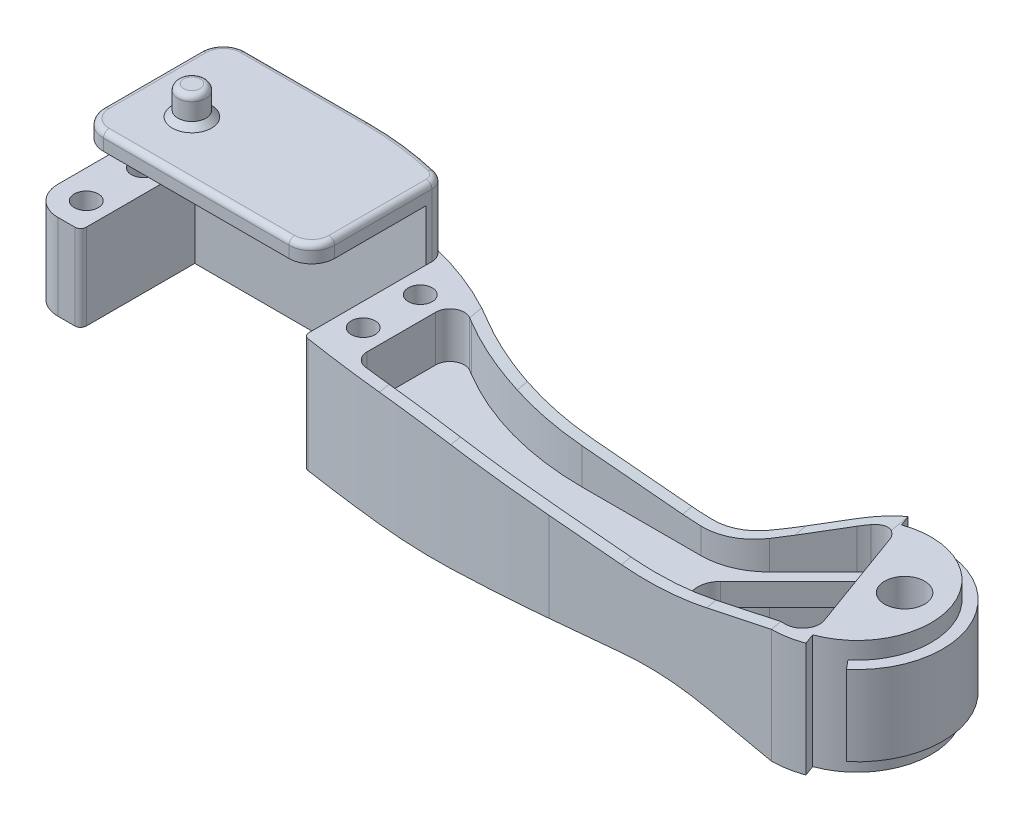
from build123d import *

# Parameters (mm, degrees)
CROQUIS1_R              = 3.5
SALIENTE_EXTRUIR1_DEPTH = 2
CROQUIS2_R              = 3.5
SALIENTE_EXTRUIR2_DEPTH = 10
SALIENTE_EXTRUIR3_DEPTH = 7
CORTAR_EXTRUIR1_DEPTH   = 83.665164829
CORTAR_EXTRUIR3_DEPTH   = 5
SALIENTE_EXTRUIR4_START = 9
SALIENTE_EXTRUIR4_DEPTH = 9
SALIENTE_EXTRUIR5_START = 3
SALIENTE_EXTRUIR5_DEPTH = 3
CROQUIS10_R             = 2.1
CORTAR_EXTRUIR4_DEPTH   = 83.909589369
CROQUIS11_R             = 2.45
SALIENTE_EXTRUIR6_DEPTH = 5
REDONDEO1_R             = 1
CHAFL_N1_SIZE           = 1
REDONDEO2_R             = 1


with BuildPart() as part:
    # Croquis1 → Saliente-Extruir1 (new, symmetric)
    with BuildSketch(Plane(origin=(0, 0, 0), x_dir=(1, 0, 0), z_dir=(0, 1, 0))):
        with BuildLine():
            Line((-65, 15), (-40.296472568, 15))
            ThreePointArc((-40.296472568, 15), (-25.597104262, 12.999326141), (-11.967141117, 7.142857143))
            ThreePointArc((-11.967141117, 7.142857143), (0.423734469, 1.818794417), (13.786796564, 0))
            Line((13.786796564, 0), (34.644660941, 0))
            ThreePointArc((34.644660941, 0), (38.471495264, 0.761204675), (41.715728753, 2.928932188))
            Line((41.715728753, 2.928932188), (49.393398282, 10.606601718))
            ThreePointArc((49.393398282, 10.606601718), (51.940505875, 12.650871687), (54.86969785, 14.095389312))
            Line((54.86969785, 14.095389312), (55.553738137, 12.21600407))
            ThreePointArc((55.553738137, 12.21600407), (57.74257369, 12.802500789), (60, 13))
            Line((60, 13), (60, 15))
            ThreePointArc((60, 15), (74.095389312, 5.13030215), (69.641814145, -11.490666647))
            Line((69.641814145, -11.490666647), (68.356238926, -9.958577761))
            ThreePointArc((68.356238926, -9.958577761), (66.5, -11.258330249), (64.446261863, -12.21600407))
            Line((64.446261863, -12.21600407), (65.13030215, -14.095389312))
            ThreePointArc((65.13030215, -14.095389312), (62.604722665, -14.772116295), (60, -15))
            Line((60, -15), (21, -15))
            ThreePointArc((21, -15), (-1.892838305, -14.125254625), (-24.652173913, -11.506119696))
            ThreePointArc((-24.652173913, -11.506119696), (-25.259003924, -11.168852013), (-25.5, -10.517765963))
            Line((-25.5, -10.517765963), (-25.5, 10))
            Line((-25.5, 10), (-66, 10))
            Line((-66, 10), (-66, -9))
            ThreePointArc((-66, -9), (-66.292893219, -9.707106781), (-67, -10))
            Line((-67, -10), (-70, -10))
            ThreePointArc((-70, -10), (-73.535533906, -8.535533906), (-75, -5))
            Line((-75, -5), (-75, 5))
            ThreePointArc((-75, 5), (-72.071067812, 12.071067812), (-65, 15))
        make_face()
        with Locations(Location((66.108002035, 2.223130932, 0), (0, 0, 270))):
            Circle(CROQUIS1_R, mode=Mode.SUBTRACT)
        with BuildLine():
            Line((57.461693581, 6.97393957), (62.538306419, -6.97393957))
            ThreePointArc((62.538306419, -6.97393957), (62.17668469, -9.720729309), (59.719228557, -11))
            Line((59.719228557, -11), (43.108950141, -11))
            ThreePointArc((43.108950141, -11), (39.413432011, -8.530733729), (40.280523016, -4.171572875))
            Line((40.280523016, -4.171572875), (52.521295375, 8.069199484))
            ThreePointArc((52.521295375, 8.069199484), (55.29193456, 8.876767161), (57.461693581, 6.97393957))
        make_face(mode=Mode.SUBTRACT)
    extrude(amount=SALIENTE_EXTRUIR1_DEPTH, both=True)

    # Croquis2 → Saliente-Extruir2 (add, symmetric)
    with BuildSketch(Plane(origin=(0, 0, 0), x_dir=(1, 0, 0), z_dir=(0, 1, 0))):
        with BuildLine():
            Line((54.86969785, 14.095389312), (55.553738137, 12.21600407))
            ThreePointArc((55.553738137, 12.21600407), (72.21600407, 4.446261863), (64.446261863, -12.21600407))
            Line((64.446261863, -12.21600407), (65.13030215, -14.095389312))
            ThreePointArc((65.13030215, -14.095389312), (62.604722665, -14.772116295), (60, -15))
            Line((60, -15), (21, -15))
            ThreePointArc((21, -15), (-1.892838305, -14.125254625), (-24.652173913, -11.506119696))
            ThreePointArc((-24.652173913, -11.506119696), (-25.259003924, -11.168852013), (-25.5, -10.517765963))
            Line((-25.5, -10.517765963), (-25.5, 10))
            Line((-25.5, 10), (-66, 10))
            Line((-66, 10), (-66, -9))
            ThreePointArc((-66, -9), (-66.292893219, -9.707106781), (-67, -10))
            Line((-67, -10), (-70, -10))
            ThreePointArc((-70, -10), (-73.535533906, -8.535533906), (-75, -5))
            Line((-75, -5), (-75, 5))
            ThreePointArc((-75, 5), (-72.071067812, 12.071067812), (-65, 15))
            Line((-65, 15), (-40.296472568, 15))
            ThreePointArc((-40.296472568, 15), (-25.597104262, 12.999326141), (-11.967141117, 7.142857143))
            ThreePointArc((-11.967141117, 7.142857143), (0.423734469, 1.818794417), (13.786796564, 0))
            Line((13.786796564, 0), (34.644660941, 0))
            ThreePointArc((34.644660941, 0), (38.471495264, 0.761204675), (41.715728753, 2.928932188))
            Line((41.715728753, 2.928932188), (49.393398282, 10.606601718))
            ThreePointArc((49.393398282, 10.606601718), (51.940505875, 12.650871687), (54.86969785, 14.095389312))
        make_face()
        with Locations(Location((66.108002035, 2.223130932, 0), (0, 0, 270))):
            Circle(CROQUIS2_R, mode=Mode.SUBTRACT)
        with BuildLine():
            Line((13.786796564, -2), (34.644660941, -2))
            ThreePointArc((34.644660941, -2), (39.236862129, -1.08655439), (43.129942315, 1.514718626))
            Line((43.129942315, 1.514718626), (50.807611845, 9.192388155))
            ThreePointArc((50.807611845, 9.192388155), (51.432121169, 9.777088132), (52.093735288, 10.319446608))
            ThreePointArc((52.093735288, 10.319446608), (54.758810503, 10.817874623), (56.737335776, 8.964096282))
            Line((56.737335776, 8.964096282), (63.262664224, -8.964096282))
            ThreePointArc((63.262664224, -8.964096282), (62.938611682, -11.65594441), (60.57666227, -12.987203726))
            ThreePointArc((60.57666227, -12.987203726), (60.288402114, -12.996800538), (60, -13))
            Line((60, -13), (21, -13))
            ThreePointArc((21, -13), (2.813818289, -12.444554152), (-15.304568528, -10.780287213))
            ThreePointArc((-15.304568528, -10.780287213), (-16.872354309, -9.955498637), (-17.5, -8.298908965))
            Line((-17.5, -8.298908965), (-17.5, 3.707419))
            ThreePointArc((-17.5, 3.707419), (-16.248849159, 5.87314654), (-13.747699378, 5.871152614))
            ThreePointArc((-13.747699378, 5.871152614), (-13.371589613, 5.651403898), (-12.997298625, 5.428571429))
            ThreePointArc((-12.997298625, 5.428571429), (-0.110788015, -0.108453806), (13.786796564, -2))
        make_face(mode=Mode.SUBTRACT)
    extrude(amount=SALIENTE_EXTRUIR2_DEPTH, both=True)

    # Croquis3 → Saliente-Extruir3 (add, symmetric)
    with BuildSketch(Plane(origin=(0, 0, 0), x_dir=(1, 0, 0), z_dir=(0, 1, 0))):
        with BuildLine():
            Line((69.641814145, -11.490666647), (68.356238926, -9.958577761))
            ThreePointArc((68.356238926, -9.958577761), (72.21600407, 4.446261863), (60, 13))
            Line((60, 13), (60, 15))
            ThreePointArc((60, 15), (74.095389312, 5.13030215), (69.641814145, -11.490666647))
        make_face()
    extrude(amount=SALIENTE_EXTRUIR3_DEPTH, both=True)

    # Croquis4 → Cortar-Extruir1 (cut, through all, along a direction that is not the sketch's normal)
    with BuildSketch(Plane.XY.offset(15)):
        with BuildLine():
            Line((60, 10), (-10, 10))
            ThreePointArc((-10, 10), (-3.285105416, 9.849625261), (3.416325828, 9.398802543))
            Line((3.416325828, 9.398802543), (33.740168262, 6.675657889))
            ThreePointArc((33.740168262, 6.675657889), (41.229778106, 6.566394932), (48.651667745, 7.577210532))
            Line((48.651667745, 7.577210532), (60, 10))
        make_face()
        with BuildLine():
            Line((60, -10), (-10, -10))
            ThreePointArc((-10, -10), (-3.285105416, -9.849625261), (3.416325828, -9.398802543))
            Line((3.416325828, -9.398802543), (33.740168262, -6.675657889))
            ThreePointArc((33.740168262, -6.675657889), (41.229778106, -6.566394932), (48.651667745, -7.577210532))
            Line((48.651667745, -7.577210532), (60, -10))
        make_face()
    extrude(amount=-CORTAR_EXTRUIR1_DEPTH, dir=(0.1736481776669275, 0, 0.9848077530122086), mode=Mode.SUBTRACT)

    # Croquis7 → Cortar-Extruir3 (cut)
    with BuildSketch(Plane(origin=(0, 10, 0), x_dir=(1, 0, 0), z_dir=(0, 1, 0))):
        with BuildLine():
            Line((-70, -10), (-67, -10))
            ThreePointArc((-67, -10), (-66.292893219, -9.707106781), (-66, -9))
            Line((-66, -9), (-66, 11))
            ThreePointArc((-66, 11), (-64.828427125, 13.828427125), (-62, 15))
            Line((-62, 15), (-65, 15))
            ThreePointArc((-65, 15), (-72.071067812, 12.071067812), (-75, 5))
            Line((-75, 5), (-75, -5))
            ThreePointArc((-75, -5), (-73.535533906, -8.535533906), (-70, -10))
        make_face()
    extrude(amount=-CORTAR_EXTRUIR3_DEPTH, mode=Mode.SUBTRACT)

    # Croquis8 → Saliente-Extruir4 (add)
    with BuildSketch(Plane(origin=(0, 10, 0), x_dir=(1, 0, 0), z_dir=(0, 1, 0)).offset(SALIENTE_EXTRUIR4_START)):
        with BuildLine():
            Line((-40.296472568, 15), (-62, 15))
            ThreePointArc((-62, 15), (-64.828427125, 13.828427125), (-66, 11))
            Line((-66, 11), (-66, 10))
            Line((-66, 10), (-25.5, 10))
            Line((-25.5, 10), (-25.5, 11.039658721))
            ThreePointArc((-25.5, 11.039658721), (-26.036092443, 12.586612861), (-27.414453687, 13.47011866))
            ThreePointArc((-27.414453687, 13.47011866), (-33.810199613, 14.616190486), (-40.296472568, 15))
        make_face()
    extrude(amount=-SALIENTE_EXTRUIR4_DEPTH)

    # Croquis9 → Saliente-Extruir5 (add)
    with BuildSketch(Plane(origin=(0, 19, 0), x_dir=(1, 0, 0), z_dir=(0, 1, 0)).offset(SALIENTE_EXTRUIR5_START)):
        with BuildLine():
            Line((-40.296472568, 15), (-62, 15))
            ThreePointArc((-62, 15), (-64.828427125, 13.828427125), (-66, 11))
            Line((-66, 11), (-66, -6))
            ThreePointArc((-66, -6), (-64.828427125, -8.828427125), (-62, -10))
            Line((-62, -10), (-29.5, -10))
            ThreePointArc((-29.5, -10), (-26.671572875, -8.828427125), (-25.5, -6))
            Line((-25.5, -6), (-25.5, 11.039658721))
            ThreePointArc((-25.5, 11.039658721), (-26.036092443, 12.586612861), (-27.414453687, 13.47011866))
            ThreePointArc((-27.414453687, 13.47011866), (-33.810199613, 14.616190486), (-40.296472568, 15))
        make_face()
    extrude(amount=-SALIENTE_EXTRUIR5_DEPTH)

    # Croquis10 → Cortar-Extruir4 (cut, through all)
    with BuildSketch(Plane.XZ.offset(10)):
        with Locations(Location((-70, -5, 0), (0, 0, 270))):
            Circle(CROQUIS10_R)
        with Locations(Location((-70, 5, 0), (0, 0, 270))):
            Circle(CROQUIS10_R)
        with Locations(Location((-21.5, -5, 0), (0, 0, 90))):
            Circle(CROQUIS10_R)
        with Locations(Location((-21.5, 5, 0), (0, 0, 90))):
            Circle(CROQUIS10_R)
    extrude(amount=-CORTAR_EXTRUIR4_DEPTH, mode=Mode.SUBTRACT)

    # Croquis11 → Saliente-Extruir6 (add)
    with BuildSketch(Plane(origin=(0, 22, 0), x_dir=(1, 0, 0), z_dir=(0, 1, 0))):
        with Locations(Location((-56.5, 0, 0), (0, 0, 270))):
            Circle(CROQUIS11_R)
    extrude(amount=SALIENTE_EXTRUIR6_DEPTH)

    # Redondeo1
    redondeo1_edges = [part.edges().sort_by_distance(p)[0] for p in [
        (-56.5, 27, -2.45),
    ]]
    fillet(redondeo1_edges, radius=REDONDEO1_R)

    # Chaflán1
    chafl_n1_edges = [part.edges().sort_by_distance(p)[0] for p in [
        (-56.5, 22, -2.45),
    ]]
    chamfer(chafl_n1_edges, length=CHAFL_N1_SIZE)

    # Redondeo2
    redondeo2_edges = [part.edges().sort_by_distance(p)[0] for p in [
        (-26.036092443, 22, -12.586612861),
        (-33.810199613, 22, -14.616190486),
        (-51.148236284, 22, -15),
        (-64.828427125, 22, -13.828427125),
        (-66, 22, -2.5),
        (-64.828427125, 22, 8.828427125),
        (-45.75, 22, 10),
        (-26.671572875, 22, 8.828427125),
        (-25.5, 22, -2.519829361),
    ]]
    fillet(redondeo2_edges, radius=REDONDEO2_R)


solid = part.part
